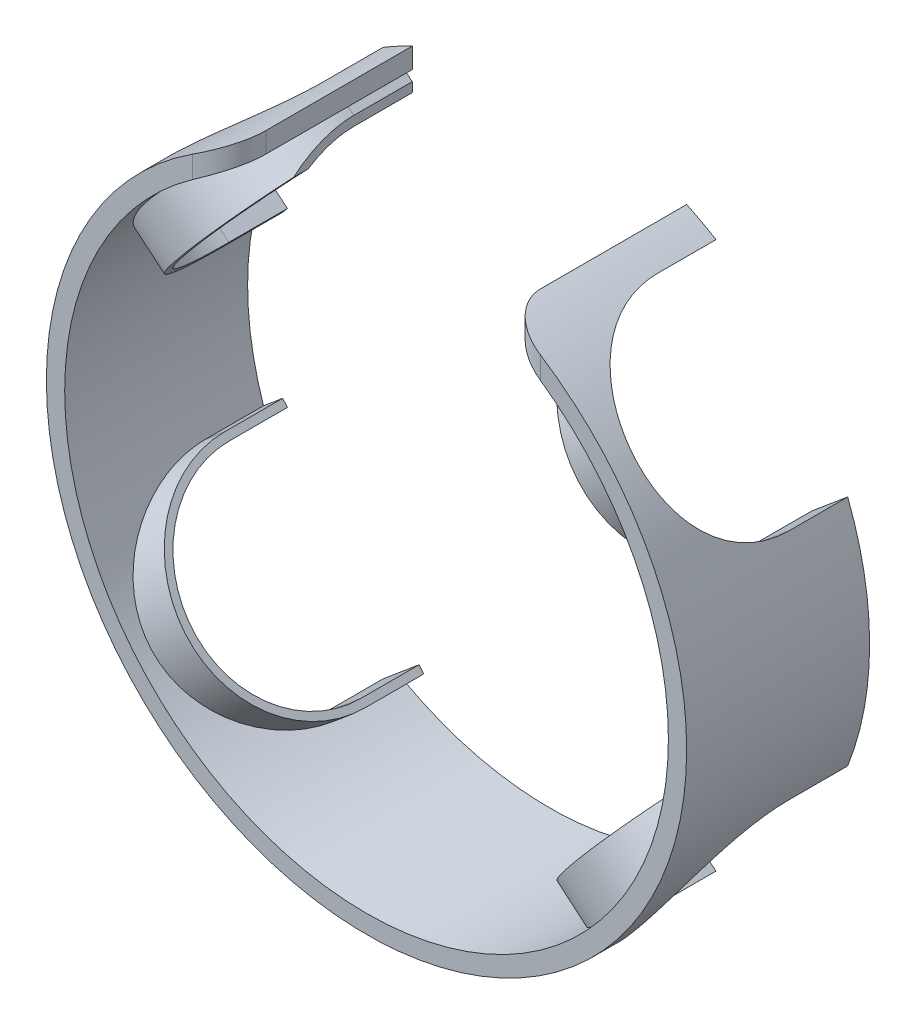
from build123d import *

# Parameters (mm, degrees)
SKETCH1_R                                     = 87.5
SKETCH1_R_2                                   = 82.49999999999999
BOSS_EXTRUDE1_DEPTH                           = 50
CUT_EXTRUDE1_DEPTH                            = 134.46347815039138
BOSS_EXTRUDE2_REACH                           = 201.927
BOSS_EXTRUDE2_END_RADIUS                      = 82.49999999999999
MIRROR1_AT_THE_SECOND_PLANE_COPY_1_DEPTH      = 134.46347815039138
MIRROR1_AT_THE_SECOND_PLANE_COPY_2_REACH      = 201.927
MIRROR1_AT_THE_SECOND_PLANE_COPY_2_END_RADIUS = 82.49999999999999
CUT_EXTRUDE2_DEPTH                            = 134.46347831897683
FILLET1_R                                     = 10.000000000000002


with BuildPart() as part:
    # Sketch1 → Boss-Extrude1 (new body)
    with BuildSketch(Plane.XY):
        Circle(SKETCH1_R)
        Circle(SKETCH1_R_2, mode=Mode.SUBTRACT)
    extrude(amount=BOSS_EXTRUDE1_DEPTH)

    # Sketch3 → Cut-Extrude1 (cut, through all)
    with BuildSketch(Plane(origin=(0, 0, 0), x_dir=(0, 0, 1), z_dir=(-0.7660444431189792, 0.6427876096865379, 0))):
        with BuildLine():
            Line((16, 28), (-21.31588633738815, 28))
            Line((-21.31588633738815, 28), (-21.31588633738815, -28))
            Line((-21.31588633738815, -28), (16, -28))
            ThreePointArc((16, -28), (44, 0), (16, 28))
        make_face()
    cut_extrude1 = extrude(amount=CUT_EXTRUDE1_DEPTH, mode=Mode.SUBTRACT)

    # Boss-Extrude2: up to this cylinder (the profile starts inside it)
    boss_extrude2_end = Plane(origin=(0, 0, 8), z_dir=(0, 0, -1)) * Cylinder(BOSS_EXTRUDE2_END_RADIUS, 569.8539999999999, mode=Mode.PRIVATE)
    # Sketch5 → Boss-Extrude2 (add, up to the surface)
    with BuildSketch(Plane(origin=(-53.623111018328544, 44.995132678057665, 0), x_dir=(0, 0, 1), z_dir=(-0.7660444431189792, 0.6427876096865379, 0)), mode=Mode.PRIVATE) as boss_extrude2_sk1:
        with BuildLine():
            Line((0, -28.000000000000014), (16, -28.000000000000014))
            ThreePointArc((16, -28.000000000000014), (44, -1.388e-14), (16, 27.99999999999998))
            Line((16, 27.99999999999998), (0, 27.99999999999998))
            Line((0, 27.99999999999998), (-3.7e-16, 29.99999999999998))
            Line((-3.7e-16, 29.99999999999998), (16.000000000000007, 29.999999999999982))
            ThreePointArc((16.000000000000007, 29.999999999999982), (46, -1.388e-14), (16, -30.000000000000014))
            Line((16, -30.000000000000014), (1.2e-16, -30.000000000000014))
            Line((1.2e-16, -30.000000000000014), (0, -28.000000000000014))
        make_face()
    boss_extrude2_tool1 = extrude(boss_extrude2_sk1.sketch, amount=BOSS_EXTRUDE2_REACH, mode=Mode.PRIVATE) & boss_extrude2_end
    boss_extrude2 = boss_extrude2_tool1.solids().sort_by_distance((-72.420765, 22.592961, 8))[0]
    add(boss_extrude2)

    # Mirror1: Cut-Extrude1, Boss-Extrude2 across plane
    add(cut_extrude1.mirror(Plane(origin=(0, 0, 0), x_dir=(0, 0, 1), z_dir=(1, 0, 0))), mode=Mode.SUBTRACT)
    add(boss_extrude2.mirror(Plane(origin=(0, 0, 0), x_dir=(0, 0, 1), z_dir=(1, 0, 0))))

    # Mirror1 at the second plane: Cut-Extrude1, Boss-Extrude2 across plane
    add(cut_extrude1.mirror(Plane.ZX), mode=Mode.SUBTRACT)
    add(boss_extrude2.mirror(Plane.ZX))

    # Mirror1 at the second plane copy 1 sketc → Mirror1 at the second plane copy 1 (cut, through all)
    with BuildSketch(Plane(origin=(0, 0, 0), x_dir=(0, 0, 1), z_dir=(0.7660444431189792, -0.6427876096865379, 0))):
        with BuildLine():
            Line((16, 28), (-21.31588633738815, 28))
            Line((-21.31588633738815, 28), (-21.31588633738815, -28))
            Line((-21.31588633738815, -28), (16, -28))
            ThreePointArc((16, -28), (44, 0), (16, 28))
        make_face()
    extrude(amount=MIRROR1_AT_THE_SECOND_PLANE_COPY_1_DEPTH, mode=Mode.SUBTRACT)

    # Mirror1 at the second plane copy 2: up to this cylinder (the profile starts inside it)
    mirror1_at_the_second_plane_copy_2_end = Plane(origin=(0, 0, 8), z_dir=(0, 0, -1)) * Cylinder(MIRROR1_AT_THE_SECOND_PLANE_COPY_2_END_RADIUS, 569.8539999999999, mode=Mode.PRIVATE)
    # Mirror1 at the second plane copy 2 sketc → Mirror1 at the second plane copy 2 (add, up to the surface)
    with BuildSketch(Plane(origin=(53.623111018328544, -44.995132678057665, 0), x_dir=(0, 0, 1), z_dir=(0.7660444431189792, -0.6427876096865379, 0)), mode=Mode.PRIVATE) as mirror1_at_the_second_plane_copy_2_sk1:
        with BuildLine():
            Line((0, -28.000000000000014), (16, -28.000000000000014))
            ThreePointArc((16, -28.000000000000014), (44, -1.388e-14), (16, 27.99999999999998))
            Line((16, 27.99999999999998), (0, 27.99999999999998))
            Line((0, 27.99999999999998), (-3.7e-16, 29.99999999999998))
            Line((-3.7e-16, 29.99999999999998), (16.000000000000007, 29.999999999999982))
            ThreePointArc((16.000000000000007, 29.999999999999982), (46, -1.388e-14), (16, -30.000000000000014))
            Line((16, -30.000000000000014), (1.2e-16, -30.000000000000014))
            Line((1.2e-16, -30.000000000000014), (0, -28.000000000000014))
        make_face()
    mirror1_at_the_second_plane_copy_2_tool1 = extrude(mirror1_at_the_second_plane_copy_2_sk1.sketch, amount=MIRROR1_AT_THE_SECOND_PLANE_COPY_2_REACH, mode=Mode.PRIVATE) & mirror1_at_the_second_plane_copy_2_end
    add(mirror1_at_the_second_plane_copy_2_tool1.solids().sort_by_distance((-72.420765, 22.592961, 8))[0])

    # Sketch4 → Cut-Extrude2 (cut, through all)
    with BuildSketch(Plane.XY.offset(50)):
        Polygon((-37.5, 150.50625054825755), (37.5, 150.50625054825755), (37.49999999999998, 0), (-37.49999999999998, 0), align=None)
    extrude(amount=-CUT_EXTRUDE2_DEPTH, mode=Mode.SUBTRACT)

    # Fillet1
    fillet1_edges = [part.edges().sort_by_distance(p)[0] for p in [
        (37.49999999999999, 76.2708168938525, 50),
        (-37.49999999999999, 76.2708168938529, 50),
    ]]
    fillet(fillet1_edges, radius=FILLET1_R)


solid = part.part
